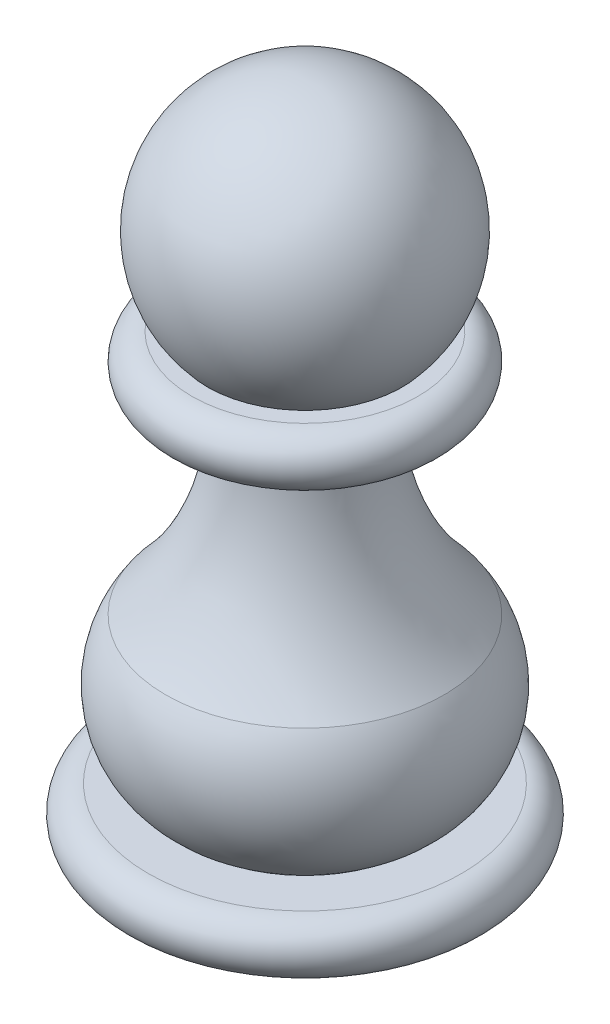
from build123d import *


with BuildPart() as part:
    # Pawn Sketch Profile → Pawn Revolve (revolve)
    with BuildSketch(Plane.XY, mode=Mode.PRIVATE) as pawn_revolve_sk:
        with BuildLine():
            Line((-5.590169944, -12.5), (0, -12.5))
            Line((0, -12.5), (0, 0))
            ThreePointArc((0, 0), (-6.846531969, -4.438137822), (-5.590169944, -12.5))
        make_face()
        with BuildLine():
            Line((-4, -15.5), (0, -15.5))
            Line((0, -15.5), (0, -12.5))
            Line((0, -12.5), (-5.590169944, -12.5))
            Line((-5.590169944, -12.5), (-6.5, -12.5))
            ThreePointArc((-6.5, -12.5), (-8, -14), (-6.5, -15.5))
            Line((-6.5, -15.5), (-4, -15.5))
        make_face()
        with BuildLine():
            Line((-6.5, -35), (0, -35))
            Line((0, -35), (0, -15.5))
            Line((0, -15.5), (-4, -15.5))
            ThreePointArc((-4, -15.5), (-4.861355712, -21.463638541), (-8, -26.607161685))
            ThreePointArc((-8, -26.607161685), (-9, -31.116347502), (-6.5, -35))
        make_face()
        with BuildLine():
            Line((-9, -38), (0, -38))
            Line((0, -38), (0, -35))
            Line((0, -35), (-6.5, -35))
            Line((-6.5, -35), (-9, -35))
            ThreePointArc((-9, -35), (-10.5, -36.5), (-9, -38))
        make_face()
    revolve(pawn_revolve_sk.sketch.rotate(Axis((0, 16.505902718, 0), (0, -1, 0)), 270), axis=Axis((0, 16.505902718, 0), (0, -1, 0)))


solid = part.part
